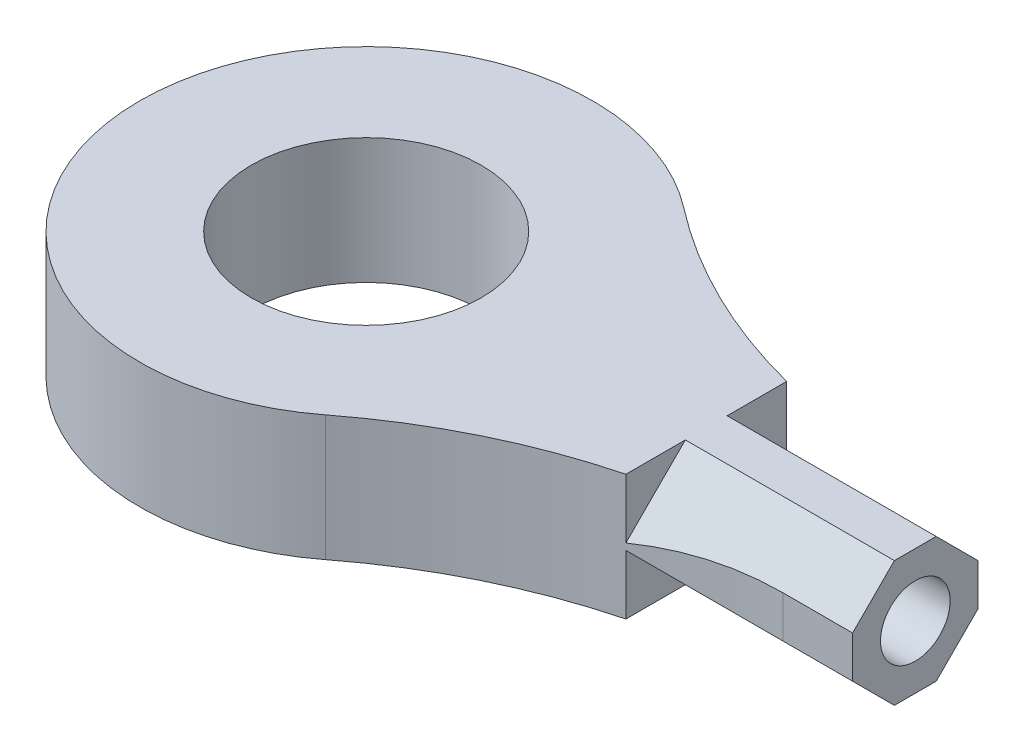
from build123d import *

# Parameters (mm, degrees)
SKETCH1_R                 = 8.25
BOSS_EXTRUDE1_DEPTH       = 9
M6X1_0_TAPPED_HOLE2_D     = 5
M6X1_0_TAPPED_HOLE2_DEPTH = 15
M6X1_0_TAPPED_HOLE2_TIP   = 1.502151548
CUT_EXTRUDE4_DEPTH        = 15


with BuildPart() as part:
    # Sketch1 → Boss-Extrude1 (new body)
    with BuildSketch(Plane(origin=(0, 0, 0), x_dir=(1, 0, 0), z_dir=(0, 1, 0))):
        with BuildLine():
            Line((39.406576406, 4.5), (39.406576406, -4.5))
            Line((39.406576406, -4.5), (34.406576406, -4.5))
            ThreePointArc((34.406576406, -4.5), (21.47943012, -6.646481156), (9.939677628, -12.855555556))
            ThreePointArc((9.939677628, -12.855555556), (-16.25, 0), (9.939677628, 12.855555556))
            ThreePointArc((9.939677628, 12.855555556), (21.47943012, 6.646481156), (34.406576406, 4.5))
            Line((34.406576406, 4.5), (39.406576406, 4.5))
        make_face()
        with Locations(Location((0, 0, 0), (0, 0, 270))):
            Circle(SKETCH1_R, mode=Mode.SUBTRACT)
    extrude(amount=BOSS_EXTRUDE1_DEPTH)

    # M6x1.0 Tapped Hole2
    with Locations(Plane(origin=(39.406576406, 0, 0), x_dir=(0, 0, -1), z_dir=(1, 0, 0))):
        with Locations((0, 4.5)):
            Hole(M6X1_0_TAPPED_HOLE2_D / 2, depth=M6X1_0_TAPPED_HOLE2_DEPTH)
            with Locations((0, 0, -(M6X1_0_TAPPED_HOLE2_DEPTH + M6X1_0_TAPPED_HOLE2_TIP / 2))):  # 118° drill point
                Cone(0, M6X1_0_TAPPED_HOLE2_D / 2, M6X1_0_TAPPED_HOLE2_TIP, mode=Mode.SUBTRACT)

    # Sketch11 → Cut-Extrude4 (cut)
    with BuildSketch(Plane(origin=(39.406576406, 0, 0), x_dir=(0, 0, -1), z_dir=(1, 0, 0))):
        Polygon((-1.5, 9), (0, 10.5), (-6, 10.5), (-6, 4.5), (-4.5, 6), (-4.5, 9), align=None)
        Polygon((-4.5, 6), (-1.5, 9), (-4.5, 9), align=None)
        Polygon((6, 10.5), (0, 10.5), (1.5, 9), (4.5, 9), (4.5, 6), (6, 4.5), align=None)
        Polygon((4.5, 9), (1.5, 9), (4.5, 6), align=None)
        Polygon((4.5, 0), (4.5, 3), (1.5, 0), align=None)
        Polygon((6, -1.5), (6, 4.5), (4.5, 3), (4.5, 0), (1.5, 0), (0, -1.5), align=None)
        Polygon((-1.5, 0), (-4.5, 3), (-4.5, 0), align=None)
        Polygon((-4.5, 3), (-6, 4.5), (-6, -1.5), (0, -1.5), (-1.5, 0), (-4.5, 0), align=None)
    extrude(amount=-CUT_EXTRUDE4_DEPTH, mode=Mode.SUBTRACT)


solid = part.part
